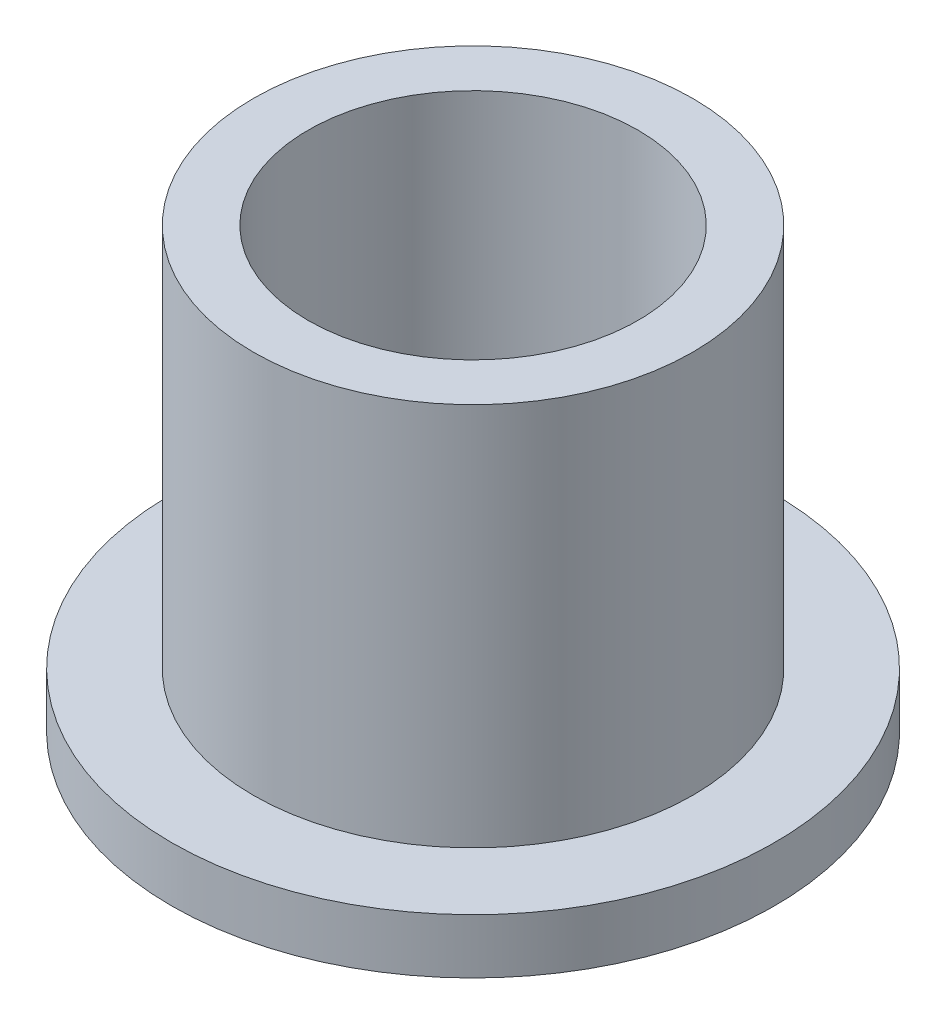
from build123d import *

# Parameters (mm, degrees)
SKETCH2_R           = 6.3627
SKETCH2_R_2         = 4.7752
BOSS_EXTRUDE1_DEPTH = 12.7
SKETCH3_R           = 8.73125
SKETCH3_R_2         = 6.3627
BOSS_EXTRUDE2_DEPTH = 1.5875


with BuildPart() as part:
    # Sketch2 → Boss-Extrude1 (new body)
    with BuildSketch(Plane(origin=(0, 0, 0), x_dir=(1, 0, 0), z_dir=(0, 1, 0))):
        with Locations(Location((0, 0, 0), (0, 0, 270))):
            Circle(SKETCH2_R)
        with Locations(Location((0, 0, 0), (0, 0, 270))):
            Circle(SKETCH2_R_2, mode=Mode.SUBTRACT)
    extrude(amount=BOSS_EXTRUDE1_DEPTH)

    # Sketch3 → Boss-Extrude2 (add)
    with BuildSketch(Plane(origin=(0, 0, 0), x_dir=(1, 0, 0), z_dir=(0, 1, 0))):
        with Locations(Location((0, 0, 0), (0, 0, 270))):
            Circle(SKETCH3_R)
        with Locations(Location((0, 0, 0), (0, 0, 270))):
            Circle(SKETCH3_R_2, mode=Mode.SUBTRACT)
    extrude(amount=BOSS_EXTRUDE2_DEPTH)


solid = part.part
